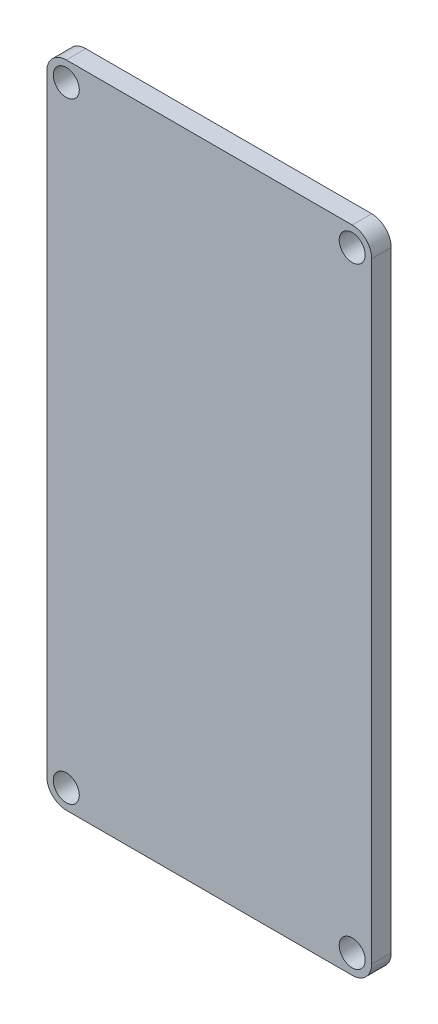
from build123d import *

# Parameters (mm, degrees)
SKETCH1_R           = 2
BOSS_EXTRUDE1_DEPTH = 3
SKETCH2_W           = 7.408333333
SKETCH2_H           = 0.664850428
SKETCH2_H_2         = 0.664850427
BOSS_EXTRUDE2_DEPTH = 1


with BuildPart() as part:
    # Sketch1 → Boss-Extrude1 (new body)
    with BuildSketch(Plane.XY):
        with BuildLine():
            ThreePointArc((24.992970236, 46.999776426), (24.114290579, 49.12109677), (21.992970236, 49.999776426))
            Line((21.992970236, 49.999776426), (-22.007029764, 49.999776426))
            ThreePointArc((-22.007029764, 49.999776426), (-24.128350108, 49.12109677), (-25.007029764, 46.999776426))
            Line((-25.007029764, 46.999776426), (-25.007029764, -47.000223574))
            ThreePointArc((-25.007029764, -47.000223574), (-24.128350108, -49.121543918), (-22.007029764, -50.000223574))
            Line((-22.007029764, -50.000223574), (21.992970236, -50.000223574))
            ThreePointArc((21.992970236, -50.000223574), (24.114290579, -49.121543918), (24.992970236, -47.000223574))
            Line((24.992970236, -47.000223574), (24.992970236, 46.999776426))
        make_face()
        with Locations((-22.007029764, -47.000223574)):
            Circle(SKETCH1_R, mode=Mode.SUBTRACT)
        with Locations((21.992970236, -47.000223574)):
            Circle(SKETCH1_R, mode=Mode.SUBTRACT)
        with Locations((-22.007029764, 46.999776426)):
            Circle(SKETCH1_R, mode=Mode.SUBTRACT)
        with Locations((21.992970236, 46.999776426)):
            Circle(SKETCH1_R, mode=Mode.SUBTRACT)
    extrude(amount=BOSS_EXTRUDE1_DEPTH)

    # Sketch2 → Boss-Extrude2 (add)
    # profile 1 of 11: a face of its own
    with BuildSketch(Plane(origin=(0, 0, 0), x_dir=(-1, 0, 0), z_dir=(0, 0, -1))):
        Polygon((12.598696431, -31.164566974), (12.598696431, -29.794797009), (20.007029764, -29.794797009), (20.007029764, -30.459647436), (13.358525491, -30.459647436), (13.358525491, -31.599391026), align=None)
    # profile 2 of 11: a face of its own
    with BuildSketch(Plane(origin=(0, 0, 0), x_dir=(-1, 0, 0), z_dir=(0, 0, -1))):
        with BuildLine():
            Line((14.87818361, -11.672873932), (14.87818361, -12.337724359))
            add(Edge.make_bspline(
                [(14.87818361, -12.337724359), (14.704819904, -12.333517607), (14.450168042, -12.305700685), (14.122768231, -12.227938578), (13.894441041, -12.147392806), (13.677189564, -12.047239991), (13.471872679, -11.927167081), (13.27927474, -11.784938578), (13.101180731, -11.623634733), (12.937800787, -11.448441021), (12.796712368, -11.25941008), (12.677512028, -11.060771667), (12.577836769, -10.853127069), (12.50310958, -10.634138839), (12.427666829, -10.325332756), (12.408427454, -10.084179718), (12.408739166, -9.921705395)],
                knots=[0, 0, 0, 0, 0.135103289, 0.198978674, 0.2619043, 0.323494969, 0.385195378, 0.446969239, 0.509764777, 0.572250569, 0.633405176, 0.693251163, 0.752583163, 0.812579266, 0.873275085, 1, 1, 1, 1], degree=3))
            add(Edge.make_bspline(
                [(12.408739166, -9.921705395), (12.408244604, -9.762055221), (12.428605351, -9.527331383), (12.496214399, -9.225723365), (12.569503276, -9.0166714), (12.661583717, -8.818649693), (12.776066971, -8.634109546), (12.907568581, -8.458588756), (13.062679044, -8.300701422), (13.228182808, -8.155663212), (13.404939403, -8.030647784), (13.587710807, -7.922988085), (13.777926509, -7.834855407), (13.976199236, -7.768107435), (14.251995483, -7.701089433), (14.467103561, -7.685550502), (14.611056206, -7.683771368)],
                knots=[0, 0, 0, 0, 0.136525004, 0.200800893, 0.263983207, 0.325711145, 0.387270514, 0.449492781, 0.512955196, 0.576266397, 0.637574967, 0.697901098, 0.757558279, 0.816587504, 0.876645757, 1, 1, 1, 1], degree=3))
            add(Edge.make_bspline(
                [(14.611056206, -7.683771368), (14.81569157, -7.682875201), (15.121114769, -7.722617255), (15.510709473, -7.850166904), (15.74516473, -7.965040383), (15.93451278, -8.079047869), (16.090077285, -8.182434032), (16.256905581, -8.304373057), (16.437026145, -8.443866345), (16.62730634, -8.603773463), (16.91238073, -8.844917754), (17.123223965, -9.044978566), (17.270457916, -9.18116887)],
                knots=[0, 0, 0, 0, 0.195649413, 0.29238821, 0.391296752, 0.444816313, 0.503919104, 0.570034929, 0.642593277, 0.72196064, 0.807943598, 1, 1, 1, 1], degree=3))
            Line((17.270457916, -9.18116887), (19.247200704, -11.034736245))
            Line((19.247200704, -11.034736245), (19.247200704, -7.588792735))
            Line((19.247200704, -7.588792735), (20.007029764, -7.588792735))
            Line((20.007029764, -7.588792735), (20.007029764, -12.622660256))
            Line((20.007029764, -12.622660256), (16.941000784, -9.749556624))
            add(Edge.make_bspline(
                [(16.941000784, -9.749556624), (16.801087424, -9.61485345), (16.598191769, -9.422758624), (16.332973524, -9.184521539), (16.158170481, -9.032079481), (15.995965825, -8.901200244), (15.851620603, -8.785052139), (15.718790386, -8.691996649), (15.564822398, -8.590979531), (15.376838753, -8.493288129), (15.071489152, -8.38089219), (14.830111492, -8.348500211), (14.670417852, -8.348621795)],
                knots=[0, 0, 0, 0, 0.212829202, 0.30610131, 0.390647321, 0.466924469, 0.534481039, 0.593586941, 0.644557005, 0.736200453, 0.825024026, 1, 1, 1, 1], degree=3))
            add(Edge.make_bspline(
                [(14.670417852, -8.348621795), (14.570762017, -8.348092251), (14.423239008, -8.363438985), (14.233289412, -8.411445401), (14.097126498, -8.462066002), (13.967066718, -8.528984253), (13.842950665, -8.610414873), (13.722959053, -8.704375149), (13.610451167, -8.813068299), (13.507409537, -8.93247278), (13.4161293, -9.058613928), (13.339849882, -9.192069943), (13.27730353, -9.332278371), (13.228296755, -9.478847301), (13.182033144, -9.686280832), (13.168982051, -9.847004309), (13.168568226, -9.955838341)],
                knots=[0, 0, 0, 0, 0.122121906, 0.180988497, 0.239933216, 0.299905831, 0.359988847, 0.421775742, 0.486575826, 0.551534805, 0.615017543, 0.677258617, 0.739729962, 0.803050103, 0.866495132, 1, 1, 1, 1], degree=3))
            add(Edge.make_bspline(
                [(13.168568226, -9.955838341), (13.168688845, -10.069694703), (13.182632348, -10.237466312), (13.227326276, -10.454478743), (13.279341348, -10.60566631), (13.340874719, -10.751158089), (13.419025321, -10.887849673), (13.509843255, -11.018010106), (13.615148939, -11.139498723), (13.733467892, -11.25045617), (13.863863338, -11.349318847), (14.005397158, -11.435127113), (14.157486486, -11.510116069), (14.321653206, -11.570919298), (14.561296412, -11.634699016), (14.749252475, -11.663695443), (14.87818361, -11.672873932)],
                knots=[0, 0, 0, 0, 0.126529667, 0.186743667, 0.245897683, 0.304053107, 0.362195516, 0.420654639, 0.480330856, 0.540662876, 0.600743511, 0.661981857, 0.724480055, 0.789067141, 0.856333337, 1, 1, 1, 1], degree=3))
        make_face()
    # profile 3 of 11: a face of its own
    with BuildSketch(Plane(origin=(0, 0, 0), x_dir=(-1, 0, 0), z_dir=(0, 0, -1))):
        with BuildLine():
            Line((14.308311815, 8.443600427), (14.308311815, 7.77875))
            add(Edge.make_bspline(
                [(14.308311815, 7.77875), (14.161440392, 7.80984247), (13.95066502, 7.876212534), (13.682556572, 7.985485601), (13.500299974, 8.081483455), (13.329280732, 8.186296391), (13.173346417, 8.306354434), (13.02853935, 8.436149179), (12.900029475, 8.579711637), (12.783660327, 8.730267396), (12.684440157, 8.889937318), (12.599092123, 9.055509112), (12.528758157, 9.228129924), (12.475854787, 9.408313595), (12.423653699, 9.659440097), (12.407750135, 9.853339116), (12.408739166, 9.984035123)],
                knots=[0, 0, 0, 0, 0.141976611, 0.208984928, 0.27395687, 0.336889347, 0.398744953, 0.460115885, 0.520824923, 0.580994459, 0.640151928, 0.698622451, 0.757271081, 0.816426694, 0.876254048, 1, 1, 1, 1], degree=3))
            add(Edge.make_bspline(
                [(12.408739166, 9.984035123), (12.407668028, 10.175273444), (12.441088762, 10.460510833), (12.553730687, 10.824017197), (12.668892125, 11.08201546), (12.811142427, 11.321660512), (12.980391671, 11.534888449), (13.173432468, 11.718791336), (13.386649784, 11.873125493), (13.614518223, 11.993785638), (13.925277035, 12.112519153), (14.17118262, 12.147224199), (14.333540515, 12.147767094)],
                knots=[0, 0, 0, 0, 0.178539792, 0.266093034, 0.354630978, 0.441886153, 0.525746915, 0.608113634, 0.690197273, 0.770821484, 0.848326181, 1, 1, 1, 1], degree=3))
            add(Edge.make_bspline(
                [(14.333540515, 12.147767094), (14.486516031, 12.147461699), (14.71429381, 12.124307517), (14.99983936, 12.030621521), (15.198778335, 11.935322306), (15.384395325, 11.811769711), (15.620986279, 11.60756118), (15.769335347, 11.418668859), (15.857650758, 11.282571114)],
                knots=[0, 0, 0, 0, 0.250608319, 0.370630166, 0.490072247, 0.610374764, 0.73431307, 1, 1, 1, 1], degree=3))
            add(Edge.make_bspline(
                [(15.857650758, 11.282571114), (15.926534596, 11.442081264), (16.107015654, 11.738278257), (16.351913504, 11.984052732), (16.48985228, 12.085437366)],
                knots=[0, 0, 0, 0, 0.50389613, 1, 1, 1, 1], degree=3))
            add(Edge.make_bspline(
                [(16.48985228, 12.085437366), (16.584286285, 12.159616271), (16.736937083, 12.252219503), (16.948537088, 12.358202576), (17.111810035, 12.419986812), (17.279193403, 12.467701449), (17.509712114, 12.513805079), (17.687030012, 12.527035987), (17.806196765, 12.527681624)],
                knots=[0, 0, 0, 0, 0.254172712, 0.378111645, 0.501712263, 0.623986309, 0.747095614, 1, 1, 1, 1], degree=3))
            add(Edge.make_bspline(
                [(17.806196765, 12.527681624), (18.013369741, 12.529289024), (18.324763247, 12.483827427), (18.721624466, 12.343360994), (19.007656983, 12.194555993), (19.275015931, 12.012077365), (19.516001349, 11.797463089), (19.719884395, 11.547556778), (19.892339274, 11.271436024), (20.028754483, 10.971005095), (20.162425314, 10.538447925), (20.196509929, 10.195376156), (20.196987029, 9.964742588)],
                knots=[0, 0, 0, 0, 0.15890809, 0.239599009, 0.322581849, 0.405999924, 0.487842619, 0.569675599, 0.653019991, 0.737412348, 0.822558452, 1, 1, 1, 1], degree=3))
            add(Edge.make_bspline(
                [(20.196987029, 9.964742588), (20.195086446, 9.809191413), (20.183469296, 9.578119941), (20.121020564, 9.282209539), (20.063267741, 9.072670373), (19.983364136, 8.875047987), (19.888116655, 8.686508321), (19.775069109, 8.507875612), (19.644035028, 8.340211161), (19.497361666, 8.183694433), (19.332612991, 8.042311132), (19.152862344, 7.914504164), (18.956498172, 7.801057986), (18.744049647, 7.701603697), (18.431002662, 7.587266952), (18.18355488, 7.523914268), (18.012478482, 7.493814103)],
                knots=[0, 0, 0, 0, 0.128956388, 0.190367128, 0.249965467, 0.308568754, 0.366415243, 0.424556413, 0.483181137, 0.542251435, 0.60174426, 0.662507715, 0.724499557, 0.789138915, 0.856353952, 1, 1, 1, 1], degree=3))
            Line((18.012478482, 7.493814103), (18.012478482, 8.15866453))
            add(Edge.make_bspline(
                [(18.012478482, 8.15866453), (18.123426911, 8.191933768), (18.285672611, 8.242670323), (18.486534672, 8.332374456), (18.620714279, 8.402442238), (18.743908409, 8.476118697), (18.886576756, 8.583338267), (18.9828537, 8.672426316), (19.036466863, 8.738924613)],
                knots=[0, 0, 0, 0, 0.29131641, 0.425966373, 0.552159574, 0.671527414, 0.786121629, 1, 1, 1, 1], degree=3))
            add(Edge.make_bspline(
                [(19.036466863, 8.738924613), (19.102293608, 8.820115028), (19.191039181, 8.950974339), (19.283849963, 9.140560261), (19.340746734, 9.291558575), (19.383348471, 9.451280623), (19.425399876, 9.679426507), (19.438153771, 9.856470557), (19.437157969, 9.976614917)],
                knots=[0, 0, 0, 0, 0.236155811, 0.355630221, 0.476249447, 0.60016412, 0.728633077, 1, 1, 1, 1], degree=3))
            add(Edge.make_bspline(
                [(19.437157969, 9.976614917), (19.437917328, 10.11224667), (19.422521824, 10.311055148), (19.37567104, 10.567507825), (19.322998425, 10.74398172), (19.257830361, 10.911050984), (19.176028562, 11.066375567), (19.080047851, 11.211993931), (18.970956917, 11.346041327), (18.851531327, 11.466575442), (18.726620412, 11.572705977), (18.596750333, 11.662921477), (18.461203824, 11.735724172), (18.320537168, 11.793104776), (18.12455297, 11.846004167), (17.972456977, 11.864896986), (17.870010533, 11.862831197)],
                knots=[0, 0, 0, 0, 0.148751715, 0.218402794, 0.285759581, 0.350598024, 0.414964045, 0.478069339, 0.541760676, 0.604349859, 0.664075021, 0.721463623, 0.777587128, 0.832644447, 0.887843511, 1, 1, 1, 1], degree=3))
            add(Edge.make_bspline(
                [(17.870010533, 11.862831197), (17.732475475, 11.862101587), (17.524470406, 11.831091177), (17.265273991, 11.722060387), (17.079796239, 11.610038534), (16.909985159, 11.470140667), (16.757391071, 11.309190532), (16.631597196, 11.122751695), (16.544604986, 10.951287854), (16.485262953, 10.799380857), (16.445733402, 10.669385927), (16.41226204, 10.523850806), (16.381118193, 10.364537193), (16.354626457, 10.190243737), (16.323996858, 9.928790886), (16.310021227, 9.724525042), (16.302863097, 9.583344017)],
                knots=[0, 0, 0, 0, 0.13348033, 0.20102742, 0.271634404, 0.34290514, 0.413858569, 0.4859963, 0.560246393, 0.599899498, 0.644068466, 0.691903727, 0.744697298, 0.801499375, 0.862862948, 1, 1, 1, 1], degree=3))
            Line((16.302863097, 9.583344017), (15.543034038, 9.583344017))
            add(Edge.make_bspline(
                [(15.543034038, 9.583344017), (15.543719085, 9.762670678), (15.523810346, 10.02746665), (15.449941455, 10.367305327), (15.372747528, 10.601330098), (15.28171232, 10.814223873), (15.176549905, 10.999671467), (15.057517574, 11.152775725), (14.926898631, 11.275187827), (14.787575674, 11.368103069), (14.593408817, 11.457476477), (14.435130181, 11.482154542), (14.330572432, 11.482916667)],
                knots=[0, 0, 0, 0, 0.215728893, 0.318103522, 0.417657931, 0.51174192, 0.596260228, 0.673404587, 0.744145217, 0.810661996, 0.874048981, 1, 1, 1, 1], degree=3))
            add(Edge.make_bspline(
                [(14.330572432, 11.482916667), (14.253458575, 11.484791541), (14.139191591, 11.46917284), (13.992714187, 11.42582541), (13.888046394, 11.379313563), (13.787868708, 11.318933997), (13.691077686, 11.24613476), (13.598925269, 11.158807272), (13.510935612, 11.061001868), (13.430889595, 10.952698723), (13.36083534, 10.836424926), (13.301410492, 10.712651823), (13.252234687, 10.582172024), (13.215323818, 10.444378619), (13.179116766, 10.248314746), (13.169142433, 10.096133431), (13.168568226, 9.99293937)],
                knots=[0, 0, 0, 0, 0.109957746, 0.163912222, 0.218089001, 0.273309497, 0.330913549, 0.390994211, 0.454640742, 0.518898068, 0.583342166, 0.648543366, 0.715052521, 0.782518585, 0.852333896, 1, 1, 1, 1], degree=3))
            add(Edge.make_bspline(
                [(13.168568226, 9.99293937), (13.168179224, 9.8284048), (13.198217286, 9.585770923), (13.308129235, 9.285491976), (13.403978668, 9.116715622), (13.498714628, 8.992080432), (13.58143587, 8.903017327), (13.673370178, 8.815557001), (13.780170863, 8.735444443), (13.894622911, 8.654454918), (14.070070771, 8.553115599), (14.210128303, 8.485411033), (14.308311815, 8.443600427)],
                knots=[0, 0, 0, 0, 0.239684964, 0.351815855, 0.463766133, 0.520817793, 0.579448291, 0.640604145, 0.705297512, 0.773633881, 0.844669382, 1, 1, 1, 1], degree=3))
        make_face()
    # profile 4 of 11: a face of its own
    with BuildSketch(Plane(origin=(0, 0, 0), x_dir=(-1, 0, 0), z_dir=(0, 0, -1))):
        Polygon((12.408739166, 31.654300548), (12.408739166, 31.789348291), (17.53758532, 31.789348291), (17.53758532, 32.644155983), (18.297414379, 32.644155983), (18.297414379, 31.789348291), (20.007029764, 31.789348291), (20.007029764, 31.124497863), (18.297414379, 31.124497863), (18.297414379, 27.610288462), align=None)
        Polygon((17.53758532, 31.124497863), (14.323152227, 31.124497863), (17.53758532, 28.917728699), align=None, mode=Mode.SUBTRACT)
    # profile 5 of 11: a face of its own
    with BuildSketch(Plane(origin=(0, 0, 0), x_dir=(-1, 0, 0), z_dir=(0, 0, -1))):
        with BuildLine():
            Line((0, -18.235897436), (-7.408333333, -18.235897436))
            Line((-7.408333333, -18.235897436), (-7.408333333, -16.739983974))
            add(Edge.make_bspline(
                [(-7.408333333, -16.739983974), (-7.407301478, -16.488644694), (-7.402023874, -16.125155567), (-7.373795263, -15.659167128), (-7.344266404, -15.351325482), (-7.307866076, -15.070936843), (-7.250472808, -14.750673513), (-7.189923092, -14.526874038), (-7.141205929, -14.389262821)],
                knots=[0, 0, 0, 0, 0.317405911, 0.458843612, 0.589366542, 0.707831319, 0.815770031, 1, 1, 1, 1], degree=3))
            add(Edge.make_bspline(
                [(-7.141205929, -14.389262821), (-7.080736471, -14.218307432), (-6.96981811, -13.971258437), (-6.784316304, -13.665022564), (-6.627935213, -13.45233396), (-6.454665558, -13.254328849), (-6.26587676, -13.068712968), (-6.057339562, -12.900075212), (-5.832775347, -12.745785477), (-5.595058793, -12.606636356), (-5.344579951, -12.485692856), (-5.082627942, -12.385253153), (-4.809926785, -12.301850954), (-4.525877381, -12.236213409), (-4.125870495, -12.175160958), (-3.818499056, -12.156160788), (-3.610672075, -12.157264957)],
                knots=[0, 0, 0, 0, 0.121697081, 0.181159, 0.240076822, 0.298685898, 0.357632728, 0.417591519, 0.47848211, 0.540396536, 0.602335896, 0.664996664, 0.728553099, 0.793645821, 0.860531077, 1, 1, 1, 1], degree=3))
            add(Edge.make_bspline(
                [(-3.610672075, -12.157264957), (-3.430161719, -12.156526899), (-3.163520785, -12.172442808), (-2.814665654, -12.219067959), (-2.565732224, -12.272013464), (-2.323738386, -12.336382954), (-2.091257943, -12.418850056), (-1.866171304, -12.513339226), (-1.651475859, -12.623476076), (-1.448202737, -12.744552883), (-1.256437882, -12.87367756), (-1.080436622, -13.013778681), (-0.915586924, -13.160709645), (-0.766292566, -13.31801368), (-0.629832104, -13.48377563), (-0.508490204, -13.658639691), (-0.400360021, -13.84368832), (-0.303662409, -14.041392892), (-0.22300413, -14.257972209), (-0.153149388, -14.492400401), (-0.097565637, -14.746014261), (-0.052795561, -15.017909602), (-0.011518863, -15.417653311), (0.001131917, -15.727601238), (0, -15.940085804)],
                knots=[0, 0, 0, 0, 0.090812897, 0.134304288, 0.177036272, 0.218837427, 0.260261591, 0.301100084, 0.341636832, 0.381609041, 0.420147801, 0.457909661, 0.494760701, 0.531219285, 0.56696076, 0.602742115, 0.638232018, 0.674761113, 0.713377828, 0.754425315, 0.797801785, 0.843978981, 0.89306439, 1, 1, 1, 1], degree=3))
            Line((0, -15.940085804), (0, -18.235897436))
        make_face()
        with BuildLine():
            Line((-0.75982906, -17.571047009), (-0.75982906, -16.72069144))
            add(Edge.make_bspline(
                [(-0.75982906, -16.72069144), (-0.759944026, -16.485687905), (-0.764426847, -16.147601515), (-0.784726933, -15.71676128), (-0.804951999, -15.437095936), (-0.831862175, -15.186744155), (-0.868878472, -14.909588146), (-0.911906824, -14.718466894), (-0.948302284, -14.602964744)],
                knots=[0, 0, 0, 0, 0.330627932, 0.475548836, 0.60674619, 0.725023803, 0.829742387, 1, 1, 1, 1], degree=3))
            add(Edge.make_bspline(
                [(-0.948302284, -14.602964744), (-0.993729622, -14.469017295), (-1.069503369, -14.271742412), (-1.206742095, -14.029945134), (-1.319745676, -13.860374109), (-1.44811839, -13.703045892), (-1.589036808, -13.556116935), (-1.743158585, -13.419769806), (-1.910230077, -13.296103805), (-2.088440601, -13.184091198), (-2.27810508, -13.08793198), (-2.476557113, -13.00419404), (-2.685403569, -12.937873222), (-2.903112536, -12.885641951), (-3.211991272, -12.83566861), (-3.450517336, -12.822158554), (-3.612156116, -12.822115385)],
                knots=[0, 0, 0, 0, 0.123333124, 0.183116954, 0.241772982, 0.300566435, 0.359665179, 0.418864294, 0.479510805, 0.540462459, 0.601912774, 0.66446721, 0.727807097, 0.79247456, 0.859249308, 1, 1, 1, 1], degree=3))
            add(Edge.make_bspline(
                [(-3.612156116, -12.822115385), (-3.782417904, -12.820157371), (-4.033235086, -12.837861403), (-4.358955582, -12.891428548), (-4.58962707, -12.948043671), (-4.811217161, -13.020307432), (-5.022501862, -13.110460841), (-5.225712133, -13.213473243), (-5.416157942, -13.336034922), (-5.596271453, -13.470264744), (-5.76127689, -13.619231039), (-5.911544968, -13.780568398), (-6.049435101, -13.952512864), (-6.169328129, -14.139926338), (-6.314454669, -14.407879377), (-6.394626907, -14.625348494), (-6.440738515, -14.773629474)],
                knots=[0, 0, 0, 0, 0.137812606, 0.203226247, 0.267174055, 0.330024003, 0.391794272, 0.453084399, 0.514333908, 0.574999993, 0.634865483, 0.694116315, 0.753441622, 0.8131258, 0.874079686, 1, 1, 1, 1], degree=3))
            add(Edge.make_bspline(
                [(-6.440738515, -14.773629474), (-6.480440722, -14.904900282), (-6.525393731, -15.119560009), (-6.56936088, -15.426036978), (-6.599225424, -15.696731234), (-6.620521239, -15.995270805), (-6.642958518, -16.449322047), (-6.649323795, -16.804236382), (-6.648504274, -17.050148571)],
                knots=[0, 0, 0, 0, 0.179284514, 0.286582528, 0.405111483, 0.535592873, 0.67819021, 1, 1, 1, 1], degree=3))
            Line((-6.648504274, -17.050148571), (-6.648504274, -17.571047009))
            Line((-6.648504274, -17.571047009), (-0.75982906, -17.571047009))
        make_face(mode=Mode.SUBTRACT)
    # profile 6 of 11: a face of its own
    with BuildSketch(Plane(origin=(0, 0, 0), x_dir=(-1, 0, 0), z_dir=(0, 0, -1))):
        with Locations((-3.704166667, -10.305181624)):
            Rectangle(SKETCH2_W, SKETCH2_H)
    # profile 7 of 11: a face of its own
    with BuildSketch(Plane(origin=(0, 0, 0), x_dir=(-1, 0, 0), z_dir=(0, 0, -1))):
        with BuildLine():
            Line((-6.143930288, -1.424679487), (-5.603739316, -1.994551282))
            add(Edge.make_bspline(
                [(-5.603739316, -1.994551282), (-5.800554516, -2.19325803), (-6.066613235, -2.513373196), (-6.355787474, -2.979983822), (-6.529499399, -3.339243071), (-6.665422509, -3.702797002), (-6.796224108, -4.177094868), (-6.839181648, -4.53807656), (-6.838461538, -4.775644364)],
                knots=[0, 0, 0, 0, 0.269020588, 0.398733209, 0.527305638, 0.652310915, 0.771699033, 1, 1, 1, 1], degree=3))
            add(Edge.make_bspline(
                [(-6.838461538, -4.775644364), (-6.840255248, -4.919105053), (-6.824636344, -5.132840535), (-6.78136191, -5.414547804), (-6.734991929, -5.622667165), (-6.676109492, -5.828557637), (-6.602485625, -6.03150563), (-6.516642251, -6.231889101), (-6.417450317, -6.427820517), (-6.308484895, -6.617771733), (-6.187730866, -6.797171927), (-6.059066048, -6.967175104), (-5.919240582, -7.124547591), (-5.769625475, -7.270336213), (-5.612915164, -7.407222532), (-5.446028547, -7.532655293), (-5.269651893, -7.644384948), (-5.087888543, -7.745281167), (-4.902279975, -7.832472007), (-4.714549427, -7.908267255), (-4.523282631, -7.966006307), (-4.330453997, -8.014869396), (-4.069135072, -8.060557755), (-3.869662344, -8.071478389), (-3.736815572, -8.073183761)],
                knots=[0, 0, 0, 0, 0.08556807, 0.12771387, 0.170061998, 0.212779251, 0.255471995, 0.298865862, 0.342847692, 0.386513065, 0.429516239, 0.471868486, 0.513710003, 0.555060853, 0.596512826, 0.637859458, 0.679560029, 0.721067725, 0.76188998, 0.801924773, 0.841812236, 0.88106488, 0.920636207, 1, 1, 1, 1], degree=3))
            add(Edge.make_bspline(
                [(-3.736815572, -8.073183761), (-3.600535723, -8.071615421), (-3.395658588, -8.060826502), (-3.127897162, -8.009921569), (-2.930064278, -7.959554205), (-2.734565924, -7.895467813), (-2.541611064, -7.816746188), (-2.351217114, -7.722964178), (-2.16527449, -7.614651851), (-1.984299205, -7.495040091), (-1.81239946, -7.363486765), (-1.651575722, -7.21977031), (-1.499478951, -7.066525881), (-1.35706903, -6.902357222), (-1.226062487, -6.725671581), (-1.104433599, -6.538942225), (-0.993518394, -6.342086325), (-0.894443186, -6.137184557), (-0.806337163, -5.927091817), (-0.733784785, -5.711132612), (-0.674628921, -5.49044385), (-0.62623308, -5.265284999), (-0.583986792, -4.955538919), (-0.567737056, -4.720242261), (-0.569871795, -4.561942441)],
                knots=[0, 0, 0, 0, 0.077886444, 0.116658333, 0.155425079, 0.194361169, 0.23400664, 0.27429462, 0.315417207, 0.356771852, 0.398060881, 0.438867116, 0.479803107, 0.521246365, 0.562815472, 0.605269167, 0.648388266, 0.691709412, 0.735133523, 0.77835607, 0.821650514, 0.865515899, 0.909726262, 1, 1, 1, 1], degree=3))
            add(Edge.make_bspline(
                [(-0.569871795, -4.561942441), (-0.570081476, -4.37333819), (-0.589194742, -4.094638267), (-0.654472619, -3.733726447), (-0.724758105, -3.479235874), (-0.813829786, -3.235634184), (-0.923952102, -3.003820053), (-1.053995648, -2.783153361), (-1.201319297, -2.574589063), (-1.365463688, -2.383086134), (-1.541008632, -2.208793907), (-1.730229559, -2.057714586), (-1.930302872, -1.925302843), (-2.143155376, -1.815951515), (-2.445277656, -1.694609999), (-2.68577362, -1.639153171), (-2.849358974, -1.614636752)],
                knots=[0, 0, 0, 0, 0.138708167, 0.204939218, 0.269469158, 0.332671241, 0.395498265, 0.457967056, 0.520866745, 0.583067903, 0.643277768, 0.702549022, 0.760882449, 0.819470671, 0.878256302, 1, 1, 1, 1], degree=3))
            Line((-2.849358974, -1.614636752), (-2.849358974, -4.084081197))
            Line((-2.849358974, -4.084081197), (-3.609188034, -4.084081197))
            Line((-3.609188034, -4.084081197), (-3.609188034, -0.949786325))
            add(Edge.make_bspline(
                [(-3.609188034, -0.949786325), (-3.332197101, -0.951584969), (-2.924920809, -0.980511402), (-2.404379763, -1.09015431), (-2.044627952, -1.199407198), (-1.707413322, -1.340984191), (-1.392398787, -1.513216381), (-1.101618119, -1.71889904), (-0.832697622, -1.950695699), (-0.592817905, -2.210834041), (-0.381983668, -2.492284335), (-0.204396024, -2.795511293), (-0.059887287, -3.120229858), (0.052784314, -3.465370022), (0.162185094, -3.964485086), (0.188862508, -4.354766345), (0.189957265, -4.619820045)],
                knots=[0, 0, 0, 0, 0.139492722, 0.204635419, 0.26740574, 0.328445598, 0.388397163, 0.447733931, 0.507391621, 0.566767555, 0.625478338, 0.684066506, 0.743248446, 0.804033357, 0.866498751, 1, 1, 1, 1], degree=3))
            add(Edge.make_bspline(
                [(0.189957265, -4.619820045), (0.189620871, -4.78477556), (0.178789459, -5.028844044), (0.143466243, -5.34889599), (0.104251712, -5.579037147), (0.056162097, -5.80327325), (-0.00540211, -6.020484722), (-0.076668237, -6.231498895), (-0.157727193, -6.436642006), (-0.251647373, -6.634051812), (-0.356018971, -6.824608499), (-0.470306637, -7.009362042), (-0.596476473, -7.187066536), (-0.73362362, -7.358600464), (-0.932577234, -7.579273181), (-1.096791126, -7.732287677), (-1.210977564, -7.829801015)],
                knots=[0, 0, 0, 0, 0.136556739, 0.202094157, 0.26646426, 0.329768823, 0.391878966, 0.453270593, 0.514114664, 0.57438951, 0.634141664, 0.693923287, 0.754152196, 0.814470164, 0.87566063, 1, 1, 1, 1], degree=3))
            add(Edge.make_bspline(
                [(-1.210977564, -7.829801015), (-1.386809351, -7.977110754), (-1.664848103, -8.176524049), (-2.064692872, -8.387837699), (-2.372802952, -8.515714436), (-2.691695216, -8.61538641), (-3.134726083, -8.712121972), (-3.477322262, -8.736165301), (-3.707134749, -8.738034188)],
                knots=[0, 0, 0, 0, 0.253668418, 0.376738432, 0.499344473, 0.621999307, 0.745698548, 1, 1, 1, 1], degree=3))
            add(Edge.make_bspline(
                [(-3.707134749, -8.738034188), (-3.880389515, -8.740054245), (-4.138403133, -8.721175794), (-4.47703599, -8.668503543), (-4.724786355, -8.611340458), (-4.967928769, -8.539146984), (-5.206578156, -8.449081052), (-5.440878204, -8.344211695), (-5.669202595, -8.222313919), (-5.88857311, -8.086701635), (-6.097916247, -7.939365463), (-6.293839186, -7.779168321), (-6.476795786, -7.60564379), (-6.649497696, -7.422289803), (-6.80833745, -7.225257133), (-6.955800584, -7.017530988), (-7.089053769, -6.797501076), (-7.208788658, -6.568639387), (-7.31375159, -6.331443437), (-7.400494609, -6.08599933), (-7.474120279, -5.834142557), (-7.528469849, -5.573966381), (-7.58213573, -5.214334219), (-7.600255465, -4.938923294), (-7.598290598, -4.753383747)],
                knots=[0, 0, 0, 0, 0.083545408, 0.124644465, 0.165304931, 0.206173076, 0.24697351, 0.288332523, 0.32999026, 0.371801673, 0.412742292, 0.453464403, 0.493832888, 0.534375408, 0.574946744, 0.615887363, 0.657245687, 0.699003207, 0.740483342, 0.782322697, 0.824565474, 0.867039742, 0.91049852, 1, 1, 1, 1], degree=3))
            add(Edge.make_bspline(
                [(-7.598290598, -4.753383747), (-7.597812608, -4.601297052), (-7.587077274, -4.374431549), (-7.551021376, -4.07542973), (-7.514597706, -3.855769885), (-7.464922379, -3.640025696), (-7.405492818, -3.427582846), (-7.336294364, -3.218133318), (-7.253768218, -3.012333483), (-7.160097822, -2.80879981), (-7.054660073, -2.606399638), (-6.935647978, -2.405828252), (-6.802723523, -2.206723383), (-6.658110175, -2.007885713), (-6.441353348, -1.743181792), (-6.268014403, -1.549386657), (-6.143930288, -1.424679487)],
                knots=[0, 0, 0, 0, 0.122179161, 0.18221627, 0.241864129, 0.300960056, 0.359969068, 0.419032918, 0.478068687, 0.537992581, 0.59896023, 0.661321079, 0.725247569, 0.791220154, 0.858745972, 1, 1, 1, 1], degree=3))
        make_face()
    # profile 8 of 11: a face of its own
    with BuildSketch(Plane(origin=(0, 0, 0), x_dir=(-1, 0, 0), z_dir=(0, 0, -1))):
        with Locations((-3.704166667, 0.902297009)):
            Rectangle(SKETCH2_W, SKETCH2_H_2)
    # profile 9 of 11: a face of its own
    with BuildSketch(Plane(origin=(0, 0, 0), x_dir=(-1, 0, 0), z_dir=(0, 0, -1))):
        Polygon((-6.648504274, 1.994551282), (-7.408333333, 1.994551282), (-7.408333333, 5.888675214), (-6.648504274, 5.888675214), (-6.648504274, 4.274038462), (0, 4.274038462), (0, 3.609188034), (-6.648504274, 3.609188034), align=None)
    # profile 10 of 11: a face of its own
    with BuildSketch(Plane(origin=(0, 0, 0), x_dir=(-1, 0, 0), z_dir=(0, 0, -1))):
        Polygon((-7.408333333, 10.257692308), (0, 13.676923077), (0, 12.954195045), (-2.374465812, 11.85897269), (-2.374465812, 8.500587607), (0, 7.375684428), (0, 6.648504274), (-7.408333333, 10.162713675), align=None)
        Polygon((-5.96287727, 10.202782786), (-3.134294872, 8.862693643), (-3.134294872, 11.508738982), align=None, mode=Mode.SUBTRACT)
    # profile 11 of 11: a face of its own
    with BuildSketch(Plane(origin=(0, 0, 0), x_dir=(-1, 0, 0), z_dir=(0, 0, -1))):
        Polygon((-7.408333333, 14.816666667), (-7.408333333, 15.481517094), (-0.75982906, 15.481517094), (-0.75982906, 18.330876068), (0, 18.330876068), (0, 14.816666667), align=None)
    extrude(amount=BOSS_EXTRUDE2_DEPTH)


solid = part.part
